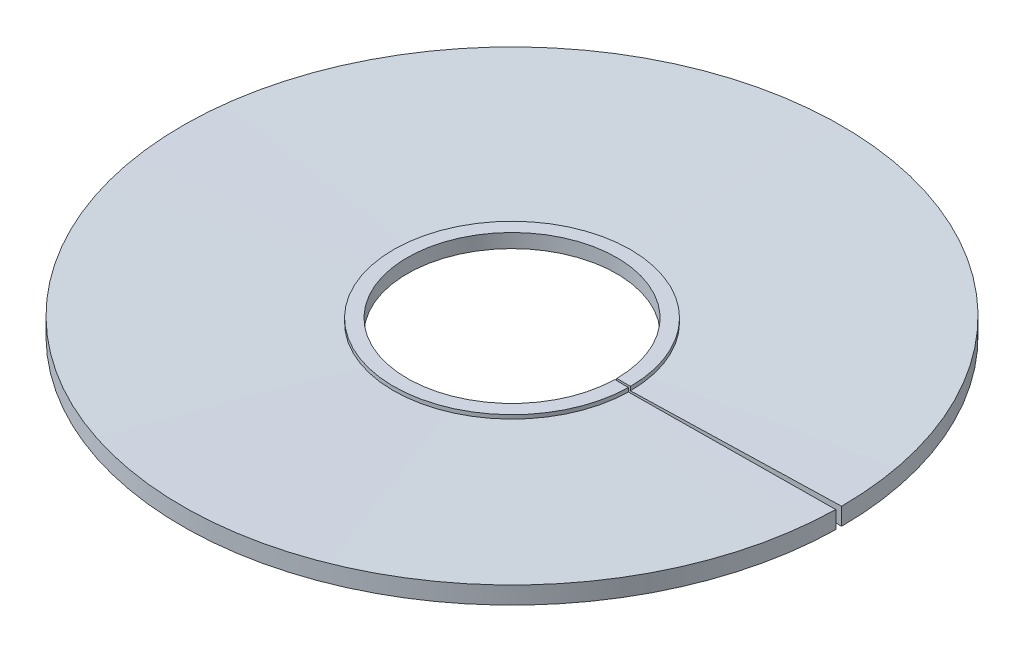
from build123d import *

# Parameters (mm, degrees)
REVOLVE1_ANGLE = 359


with BuildPart() as part:
    # Sketch1 → Revolve1 (revolve)
    with BuildSketch(Plane.XY):
        Polygon((43.1, 2.54), (38.1, 2.54), (38.1, -2.54), (43.1, -2.54), (43.1, -1.143), (119.888, -3.175), (119.888, 3.175), (43.1, 1.143), align=None)
    revolve(axis=Axis((0, 0, 0), (0, 1, 0)), revolution_arc=REVOLVE1_ANGLE)


solid = part.part
